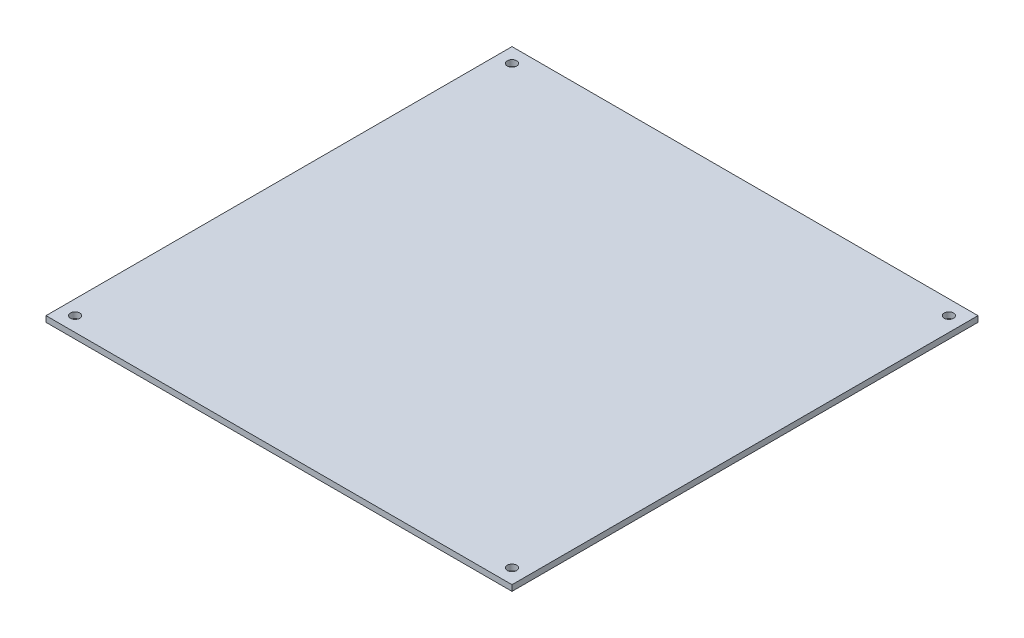
from build123d import *

# Parameters (mm, degrees)
SKETCH1_W           = 400
SKETCH1_H           = 400
BOSS_EXTRUDE1_DEPTH = 5
SKETCH2_R           = 4
CUT_EXTRUDE1_DEPTH  = 283.886903196


with BuildPart() as part:
    # Sketch1 → Boss-Extrude1 (new body)
    with BuildSketch(Plane(origin=(0, 0, 0), x_dir=(1, 0, 0), z_dir=(0, 1, 0))):
        Rectangle(SKETCH1_W, SKETCH1_H)
    extrude(amount=BOSS_EXTRUDE1_DEPTH)

    # Sketch2 → Cut-Extrude1 (cut, through all)
    with BuildSketch(Plane(origin=(0, 5, 0), x_dir=(1, 0, 0), z_dir=(0, 1, 0))):
        with Locations(Location((-187.5, 187.5, 0), (0, 0, 270))):
            Circle(SKETCH2_R)
        with Locations(Location((187.5, 187.5, 0), (0, 0, 90))):
            Circle(SKETCH2_R)
        with Locations(Location((-187.5, -187.5, 0), (0, 0, 90))):
            Circle(SKETCH2_R)
        with Locations(Location((187.5, -187.5, 0), (0, 0, 270))):
            Circle(SKETCH2_R)
    extrude(amount=-CUT_EXTRUDE1_DEPTH, mode=Mode.SUBTRACT)


solid = part.part
